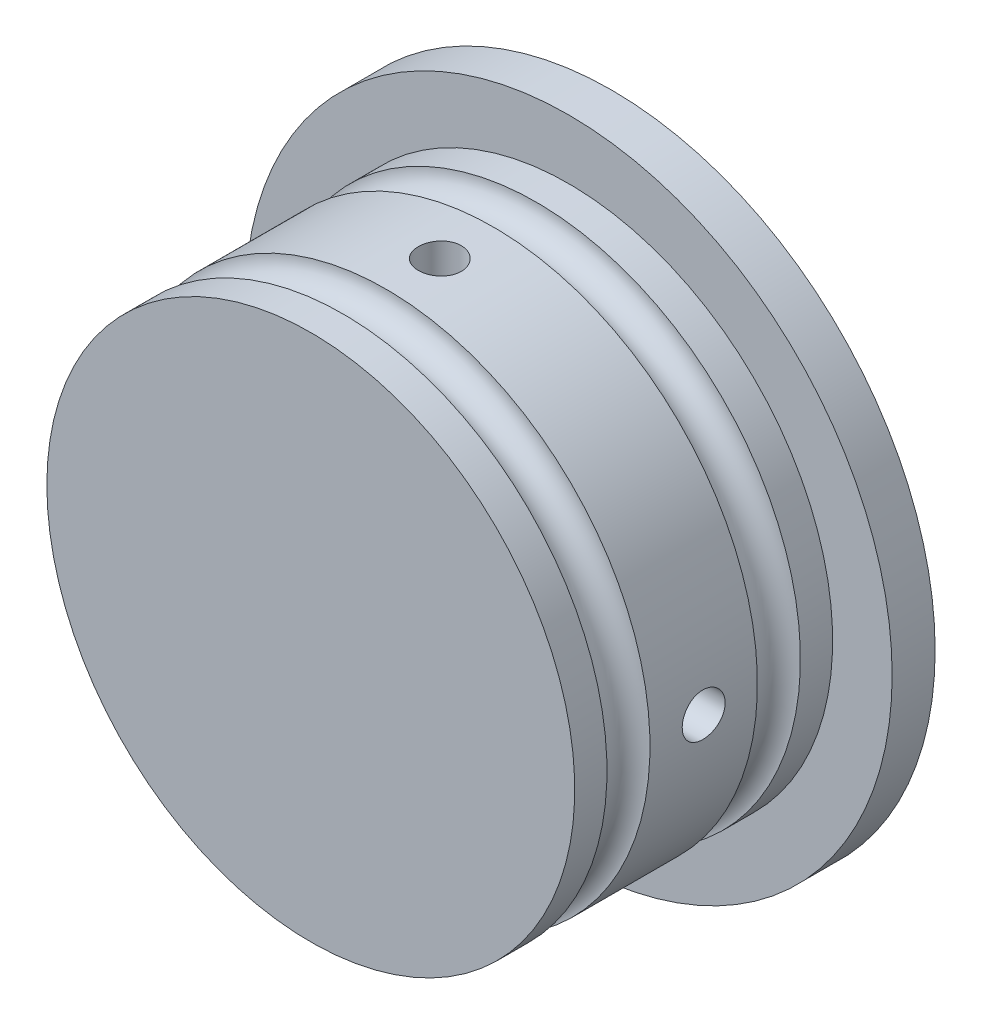
from build123d import *

# Parameters (mm, degrees)
F_4_0MM_DOWEL_HOLE2_D               = 4
F_4_0MM_DOWEL_HOLE2_DEPTH           = 8
F_4_0MM_DOWEL_HOLE2_TIP             = 1.201721238
F_4_0MM_DOWEL_HOLE2_ON_FACE_2_D     = 4
F_4_0MM_DOWEL_HOLE2_ON_FACE_2_DEPTH = 8
F_4_0MM_DOWEL_HOLE2_ON_FACE_2_TIP   = 1.201721238
F_4_0MM_DOWEL_HOLE2_ON_FACE_3_D     = 4
F_4_0MM_DOWEL_HOLE2_ON_FACE_3_DEPTH = 8
F_4_0MM_DOWEL_HOLE2_ON_FACE_3_TIP   = 1.201721238
F_4_0MM_DOWEL_HOLE2_ON_FACE_4_D     = 4
F_4_0MM_DOWEL_HOLE2_ON_FACE_4_DEPTH = 8
F_4_0MM_DOWEL_HOLE2_ON_FACE_4_TIP   = 1.201721238
F_6_0MM_DOWEL_HOLE1_D               = 6
F_6_0MM_DOWEL_HOLE1_DEPTH           = 15
F_6_0MM_DOWEL_HOLE1_TIP             = 1.802581857


with BuildPart() as part:
    # Sketch1 → Revolve1 (revolve)
    with BuildSketch(Plane(origin=(0, 0, 0), x_dir=(1, 0, 0), z_dir=(0, 1, 0)), mode=Mode.PRIVATE) as revolve1_sk:
        with BuildLine():
            Line((0, 28), (0, 0))
            Line((0, 0), (24.5618, 0))
            Line((24.5618, 0), (24.5618, 3))
            ThreePointArc((24.5618, 3), (22.5618, 5), (24.5618, 7))
            Line((24.5618, 7), (24.5618, 17))
            ThreePointArc((24.5618, 17), (22.5618, 19), (24.5618, 21))
            Line((24.5618, 21), (24.5618, 24))
            Line((24.5618, 24), (30.099, 24))
            Line((30.099, 24), (30.099, 28))
            Line((30.099, 28), (0, 28))
        make_face()
    revolve(revolve1_sk.sketch.rotate(Axis((0, 0, 0), (0, 0, 1)), 180), axis=Axis((0, 0, 0), (0, 0, 1)))

    # Ø4.0mm Dowel Hole2
    with Locations(Plane(origin=(0, 24.5618, -12), x_dir=(1, 0, 0), z_dir=(0, 1, 0))):
        with Locations((0, 0)):
            Hole(F_4_0MM_DOWEL_HOLE2_D / 2, depth=F_4_0MM_DOWEL_HOLE2_DEPTH)
            with Locations((0, 0, -(F_4_0MM_DOWEL_HOLE2_DEPTH + F_4_0MM_DOWEL_HOLE2_TIP / 2))):  # 118° drill point
                Cone(0, F_4_0MM_DOWEL_HOLE2_D / 2, F_4_0MM_DOWEL_HOLE2_TIP, mode=Mode.SUBTRACT)

    # Ø4.0mm Dowel Hole2 on face 2
    with Locations(Plane(origin=(24.5618, 0, -12), x_dir=(0, 0, 1), z_dir=(1, 0, 0))):
        with Locations((0, 0)):
            Hole(F_4_0MM_DOWEL_HOLE2_ON_FACE_2_D / 2, depth=F_4_0MM_DOWEL_HOLE2_ON_FACE_2_DEPTH)
            with Locations((0, 0, -(F_4_0MM_DOWEL_HOLE2_ON_FACE_2_DEPTH + F_4_0MM_DOWEL_HOLE2_ON_FACE_2_TIP / 2))):  # 118° drill point
                Cone(0, F_4_0MM_DOWEL_HOLE2_ON_FACE_2_D / 2, F_4_0MM_DOWEL_HOLE2_ON_FACE_2_TIP, mode=Mode.SUBTRACT)

    # Ø4.0mm Dowel Hole2 on face 3
    with Locations(Plane(origin=(0, -24.5618, -12), x_dir=(0, 0, -1), z_dir=(0, -1, 0))):
        with Locations((0, 0)):
            Hole(F_4_0MM_DOWEL_HOLE2_ON_FACE_3_D / 2, depth=F_4_0MM_DOWEL_HOLE2_ON_FACE_3_DEPTH)
            with Locations((0, 0, -(F_4_0MM_DOWEL_HOLE2_ON_FACE_3_DEPTH + F_4_0MM_DOWEL_HOLE2_ON_FACE_3_TIP / 2))):  # 118° drill point
                Cone(0, F_4_0MM_DOWEL_HOLE2_ON_FACE_3_D / 2, F_4_0MM_DOWEL_HOLE2_ON_FACE_3_TIP, mode=Mode.SUBTRACT)

    # Ø4.0mm Dowel Hole2 on face 4
    with Locations(Plane(origin=(-24.5618, 0, -12), x_dir=(0, 0, -1), z_dir=(-1, 0, 0))):
        with Locations((0, 0)):
            Hole(F_4_0MM_DOWEL_HOLE2_ON_FACE_4_D / 2, depth=F_4_0MM_DOWEL_HOLE2_ON_FACE_4_DEPTH)
            with Locations((0, 0, -(F_4_0MM_DOWEL_HOLE2_ON_FACE_4_DEPTH + F_4_0MM_DOWEL_HOLE2_ON_FACE_4_TIP / 2))):  # 118° drill point
                Cone(0, F_4_0MM_DOWEL_HOLE2_ON_FACE_4_D / 2, F_4_0MM_DOWEL_HOLE2_ON_FACE_4_TIP, mode=Mode.SUBTRACT)

    # Ø6.0mm Dowel Hole1
    with Locations(Plane(origin=(0, 0, -28), x_dir=(-1, 0, 0), z_dir=(0, 0, -1))):
        with Locations((0, 0)):
            Hole(F_6_0MM_DOWEL_HOLE1_D / 2, depth=F_6_0MM_DOWEL_HOLE1_DEPTH)
            with Locations((0, 0, -(F_6_0MM_DOWEL_HOLE1_DEPTH + F_6_0MM_DOWEL_HOLE1_TIP / 2))):  # 118° drill point
                Cone(0, F_6_0MM_DOWEL_HOLE1_D / 2, F_6_0MM_DOWEL_HOLE1_TIP, mode=Mode.SUBTRACT)


solid = part.part
